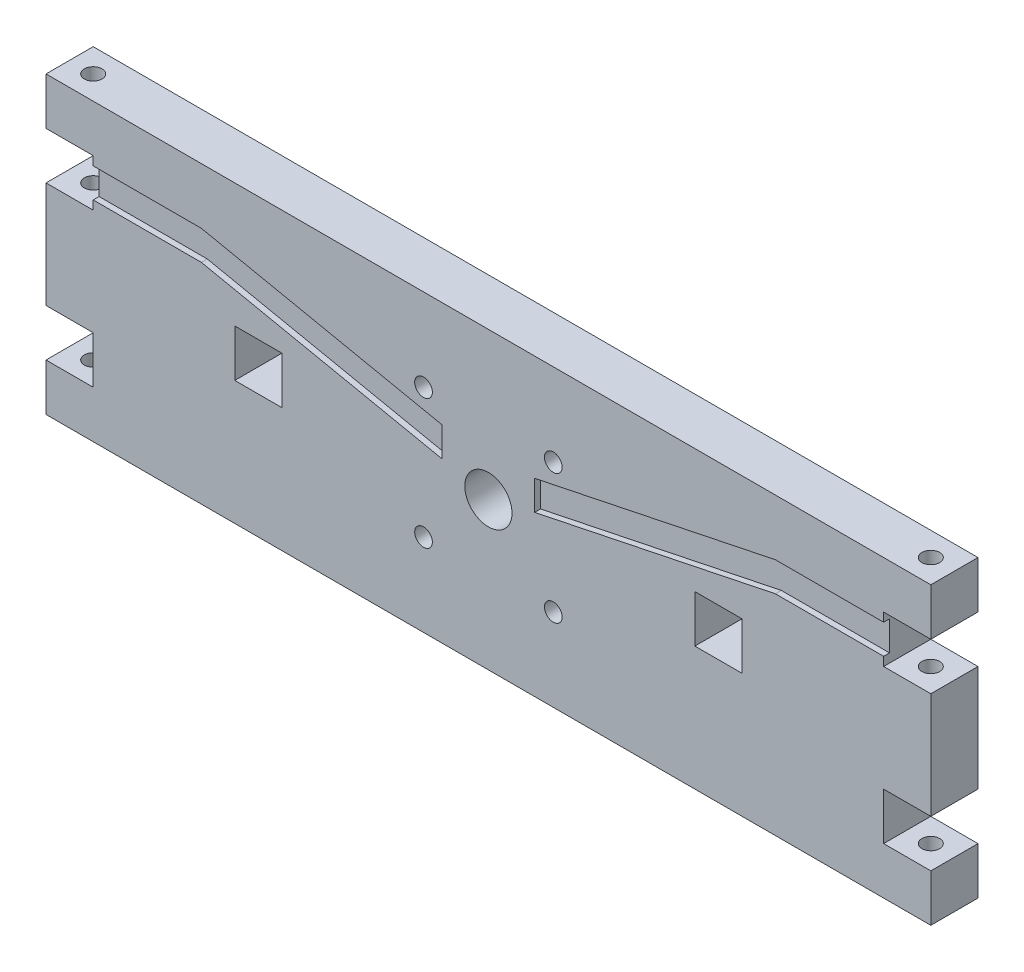
from build123d import *

# Parameters (mm, degrees)
SKETCH1_W                                  = 150
SKETCH1_H                                  = 50
U_ARM_BOTTOM_BOSS_EXTRUDE1_DEPTH           = 8
SKETCH2_W                                  = 8
SKETCH2_H                                  = 8
PUZZLE_SLOT_CUT_EXTRUDE1_DEPTH             = 8
SKETCH3_R                                  = 4
CENTER_SHAFT_HOLE_CUT_EXTRUDE2_DEPTH       = 8
PUZZLE_SLOT_SCREW_HOLES_CUT_EXTRUDE3_REACH = 92.493
SKETCH4_R                                  = 1.5
SIDE_PUZZLE_SLOTS_CUT_EXTRUDE4_DEPTH       = 8
CABLE_CUT_EXTRUDE13_DEPTH                  = 1
SKETCH7_R                                  = 1.5
DISTANS_MOUNTING_HOLES_CUT_EXTRUDE1_DEPTH  = 8


with BuildPart() as part:
    # Sketch1 → U-Arm Bottom Boss-Extrude1 (new body)
    with BuildSketch(Plane.XY):
        Rectangle(SKETCH1_W, SKETCH1_H)
    extrude(amount=-U_ARM_BOTTOM_BOSS_EXTRUDE1_DEPTH)

    # Sketch2 → Puzzle Slot Cut-Extrude1 (cut)
    with BuildSketch(Plane.XY):
        with Locations((71, 13)):
            Rectangle(SKETCH2_W, SKETCH2_H)
        with Locations((71, -13)):
            Rectangle(SKETCH2_W, SKETCH2_H)
        with Locations((-71, -13)):
            Rectangle(SKETCH2_W, SKETCH2_H)
        with Locations((-71, 13)):
            Rectangle(SKETCH2_W, SKETCH2_H)
    extrude(amount=-PUZZLE_SLOT_CUT_EXTRUDE1_DEPTH, mode=Mode.SUBTRACT)

    # Sketch3 → Center Shaft Hole Cut-Extrude2 (cut)
    with BuildSketch(Plane.XY):
        Circle(SKETCH3_R)
    extrude(amount=-CENTER_SHAFT_HOLE_CUT_EXTRUDE2_DEPTH, mode=Mode.SUBTRACT)

    # Puzzle Slot Screw Holes Cut-Extrude3: up to this face of the body (flat: up to its plane)
    puzzle_slot_screw_holes_cut_extrude3_end = Plane(part.part.faces().sort_by_distance((0, 25, -4))[0])
    # Sketch4 → Puzzle Slot Screw Holes Cut-Extrude3 (cut, up to the picked face)
    with BuildSketch(Plane.XZ.offset(25), mode=Mode.PRIVATE) as puzzle_slot_screw_holes_cut_extrude3_sk1:
        with Locations(Location((-71, -4, 0), (0, 0, 90))):
            Circle(SKETCH4_R)
    puzzle_slot_screw_holes_cut_extrude3_tool1 = split(extrude(puzzle_slot_screw_holes_cut_extrude3_sk1.sketch, amount=-PUZZLE_SLOT_SCREW_HOLES_CUT_EXTRUDE3_REACH, mode=Mode.PRIVATE), bisect_by=puzzle_slot_screw_holes_cut_extrude3_end, keep=Keep.BOTH, mode=Mode.PRIVATE)
    # Sketch4 → Puzzle Slot Screw Holes Cut-Extrude3 (cut, up to the picked face)
    with BuildSketch(Plane.XZ.offset(25), mode=Mode.PRIVATE) as puzzle_slot_screw_holes_cut_extrude3_sk2:
        with Locations((71, -4)):
            Circle(SKETCH4_R)
    puzzle_slot_screw_holes_cut_extrude3_tool2 = split(extrude(puzzle_slot_screw_holes_cut_extrude3_sk2.sketch, amount=-PUZZLE_SLOT_SCREW_HOLES_CUT_EXTRUDE3_REACH, mode=Mode.PRIVATE), bisect_by=puzzle_slot_screw_holes_cut_extrude3_end, keep=Keep.BOTH, mode=Mode.PRIVATE)
    add(puzzle_slot_screw_holes_cut_extrude3_tool1.solids().sort_by(Axis((-71, -25, -4), (0, 1, 0)))[0], mode=Mode.SUBTRACT)
    add(puzzle_slot_screw_holes_cut_extrude3_tool2.solids().sort_by(Axis((71, -25, -4), (0, 1, 0)))[0], mode=Mode.SUBTRACT)

    # Sketch5 → Side Puzzle Slots Cut-Extrude4 (cut)
    with BuildSketch(Plane.XY):
        Polygon((-35, 4), (-35, 0), (-35, -4), (-43, -4), (-43, 4), align=None)
        Polygon((43, 4), (43, -4), (35, -4), (35, 0), (35, 4), align=None)
    extrude(amount=-SIDE_PUZZLE_SLOTS_CUT_EXTRUDE4_DEPTH, mode=Mode.SUBTRACT)

    # Sketch6 → Cable Cut-Extrude13 (cut)
    with BuildSketch(Plane.XY):
        Polygon((67, 15.5), (48.657587673, 15.5), (7.841649412, 7.048524191), (7.841649412, 2.048524191), (48.657587673, 10.5), (67, 10.5), align=None)
        Polygon((-7.841649412, 7.048524191), (-7.841649412, 2.048524191), (-48.657587673, 10.5), (-67, 10.5), (-67, 15.5), (-48.657587673, 15.5), align=None)
    extrude(amount=-CABLE_CUT_EXTRUDE13_DEPTH, mode=Mode.SUBTRACT)

    # Sketch7 → Distans Mounting Holes Cut-Extrude1 (cut)
    with BuildSketch(Plane.XY):
        with Locations((11, 11)):
            Circle(SKETCH7_R)
        with Locations((-11, 11)):
            Circle(SKETCH7_R)
        with Locations((-11, -11)):
            Circle(SKETCH7_R)
        with Locations((11, -11)):
            Circle(SKETCH7_R)
    extrude(amount=-DISTANS_MOUNTING_HOLES_CUT_EXTRUDE1_DEPTH, mode=Mode.SUBTRACT)


solid = part.part
